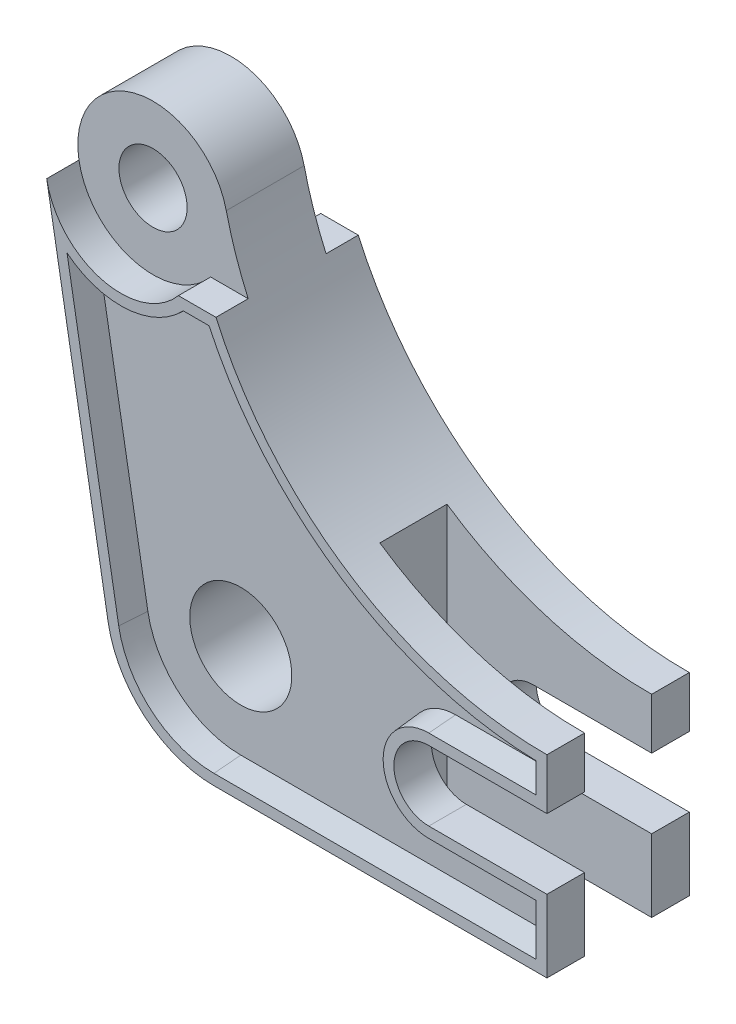
from build123d import *

# Parameters (mm, degrees)
SKETCH2_R               = 6.35
SKETCH2_R_2             = 9.5
BOSS_EXTRUDE2_DEPTH     = 26.5
CUT_EXTRUDE1_START      = -6
CUT_EXTRUDE1_DEPTH      = 6
CUT_EXTRUDE2_DEPTH      = 6
CUT_EXTRUDE3_DEPTH      = 6.25
CUT_EXTRUDE3_DEPTH_BACK = 6.25
CUT_EXTRUDE7_DEPTH      = 5
CUT_EXTRUDE7_DRAFT      = -5


with BuildPart() as part:
    # Sketch2 → Boss-Extrude2 (new body)
    with BuildSketch(Plane.XY):
        with BuildLine():
            Line((0, 0), (-62, 0))
            ThreePointArc((-62, 0), (-74.874173195, 4.694587084), (-81.704453671, 16.574433546))
            Line((-81.704453671, 16.574433546), (-93.133993592, 82.319133844))
            ThreePointArc((-93.133993592, 82.319133844), (-82.120785811, 98.438258498), (-65.702115422, 87.876810306))
            ThreePointArc((-65.702115422, 87.876810306), (-41.950384105, 50.414084566), (0, 36))
            Line((0, 36), (0, 26.5))
            Line((0, 26.5), (-22, 26.5))
            ThreePointArc((-22, 26.5), (-28.5, 20), (-22, 13.5))
            Line((-22, 13.5), (0, 13.5))
            Line((0, 13.5), (0, 0))
        make_face()
        with Locations((-79.340876022, 84.717030361)):
            Circle(SKETCH2_R, mode=Mode.SUBTRACT)
        with Locations((-62, 20)):
            Circle(SKETCH2_R_2, mode=Mode.SUBTRACT)
    extrude(amount=BOSS_EXTRUDE2_DEPTH)

    # Sketch3 → Cut-Extrude1 (cut)
    with BuildSketch(Plane.XY.offset(26.5).offset(CUT_EXTRUDE1_START)):
        with BuildLine():
            Line((-68.617070727, 75.717030361), (-61.624981931, 75.717030361))
            ThreePointArc((-61.624981931, 75.717030361), (-63.955170346, 81.699140564), (-65.702115422, 87.876810306))
            ThreePointArc((-65.702115422, 87.876810306), (-92.955159562, 87.980660806), (-68.617070727, 75.717030361))
        make_face()
    extrude(amount=CUT_EXTRUDE1_DEPTH, mode=Mode.SUBTRACT)

    # Sketch4 → Cut-Extrude2 (cut)
    with BuildSketch(Plane(origin=(0, 0, 0), x_dir=(-1, 0, 0), z_dir=(0, 0, -1))):
        with BuildLine():
            Line((68.617070727, 75.717030361), (61.624981931, 75.717030361))
            ThreePointArc((61.624981931, 75.717030361), (63.955170346, 81.699140564), (65.702115422, 87.876810306))
            ThreePointArc((65.702115422, 87.876810306), (92.955159562, 87.980660806), (68.617070727, 75.717030361))
        make_face()
    extrude(amount=-CUT_EXTRUDE2_DEPTH, mode=Mode.SUBTRACT)

    # Sketch6 → Cut-Extrude3 (cut, two sides: drawn at the far end of the back side and taken through both)
    with BuildSketch(Plane.XY.offset(13.25).offset(-CUT_EXTRUDE3_DEPTH_BACK)):
        with BuildLine():
            Line((0, 0), (-38.108793453, 0))
            Line((-38.108793453, 0), (-38.108793453, 47.596659083))
            ThreePointArc((-38.108793453, 47.596659083), (-19.936162439, 38.900682282), (0, 36))
            Line((0, 36), (0, 0))
        make_face()
    extrude(amount=CUT_EXTRUDE3_DEPTH + CUT_EXTRUDE3_DEPTH_BACK, mode=Mode.SUBTRACT)


with BuildPart() as cut_extrude7_tool:
    # Sketch7 → Cut-Extrude7 (with draft: the straight prism first)
    with BuildSketch(Plane.XY.offset(26.5)):
        with BuildLine():
            Line((-89.350908837, 72.235073662), (-79.734008304, 16.916990192))
            ThreePointArc((-79.734008304, 16.916990192), (-73.586755876, 6.225128375), (-62, 2))
            Line((-62, 2), (-2, 2))
            Line((-2, 2), (-2, 11.5))
            Line((-2, 11.5), (-22, 11.5))
            ThreePointArc((-22, 11.5), (-30.5, 20), (-22, 28.5))
            Line((-22, 28.5), (-2, 28.5))
            Line((-2, 28.5), (-2, 34.016457666))
            ThreePointArc((-2, 34.016457666), (-38.108007625, 45.193460051), (-62.909611076, 73.717030361))
            Line((-62.909611076, 73.717030361), (-67.721925983, 73.717030361))
            ThreePointArc((-67.721925983, 73.717030361), (-78.247165561, 68.754455462), (-89.350908837, 72.235073662))
        make_face()
    extrude(amount=-CUT_EXTRUDE7_DEPTH)
    # Cut-Extrude7: the draft: its side faces are tilted about the plane it starts from
    cut_extrude7_sides = [cut_extrude7_tool.faces().sort_by_distance(p)[0] for p in [
        (-38.108007625, 45.193460051, 24),
        (-65.31576853, 73.717030361, 24),
        (-78.247165561, 68.754455462, 24),
        (-84.542458571, 44.576031927, 24),
        (-73.586755876, 6.225128375, 24),
        (-32, 2, 24),
        (-2, 6.75, 24),
        (-12, 11.5, 24),
        (-30.5, 20, 24),
        (-12, 28.5, 24),
        (-2, 31.258228833, 24),
    ]]
    draft(cut_extrude7_sides, Plane.XY.offset(26.5), CUT_EXTRUDE7_DRAFT)


with BuildPart() as part_1:
    add(part.part)

    # Cut-Extrude7: cut by cut_extrude7_tool
    add(cut_extrude7_tool.part, mode=Mode.SUBTRACT)


solid = part_1.part
